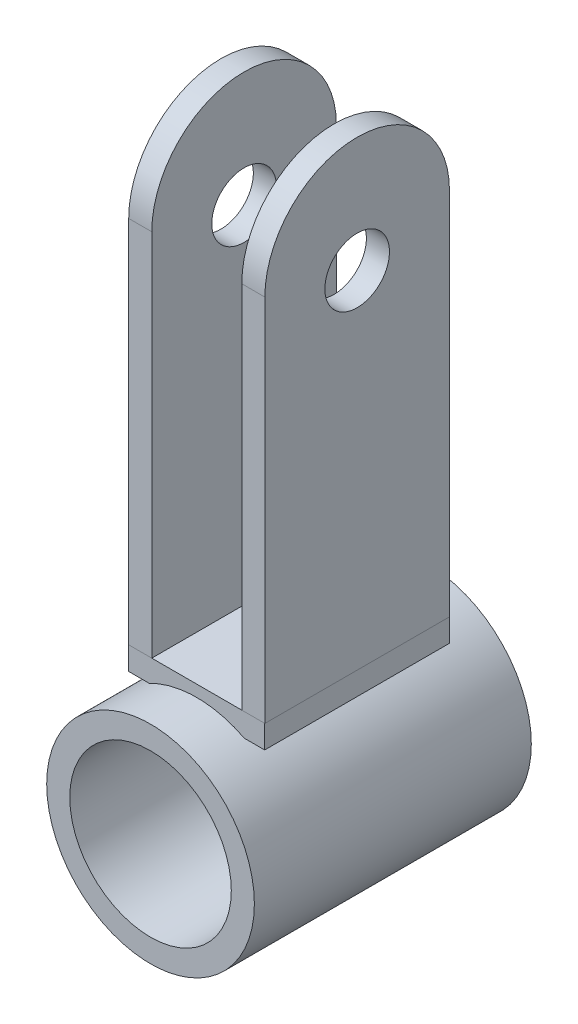
from build123d import *

# Parameters (mm, degrees)
SKETCH1_R           = 22.5
SKETCH1_R_2         = 17.5
BOSS_EXTRUDE1_DEPTH = 30
SKETCH6_W           = 29.462107424
SKETCH6_H           = 40
BOSS_EXTRUDE7_DEPTH = 5
SKETCH8_R           = 7
BOSS_EXTRUDE8_DEPTH = 5
LPATTERN2_COUNT     = 2
LPATTERN2_PITCH     = 24.5


with BuildPart() as part:
    # Sketch1 → Boss-Extrude1 (new, symmetric)
    with BuildSketch(Plane.XY):
        Circle(SKETCH1_R)
        Circle(SKETCH1_R_2, mode=Mode.SUBTRACT)
    extrude(amount=BOSS_EXTRUDE1_DEPTH, both=True)

    # Sketch6 → Boss-Extrude7 (add)
    with BuildSketch(Plane(origin=(0, 20, 0), x_dir=(1, 0, 0), z_dir=(0, 1, 0))):
        Rectangle(SKETCH6_W, SKETCH6_H)
    extrude(amount=BOSS_EXTRUDE7_DEPTH)


with BuildPart() as body_2:
    # Sketch8 → Boss-Extrude8 (new body)
    with BuildSketch(Plane.ZY.offset(14.731053712)):
        with BuildLine():
            Line((20, 25), (20, 105))
            ThreePointArc((20, 105), (0, 125), (-20, 105))
            Line((-20, 105), (-20, 25))
            Line((-20, 25), (20, 25))
        make_face()
        with Locations((0, 100)):
            Circle(SKETCH8_R, mode=Mode.SUBTRACT)
    boss_extrude8 = extrude(amount=-BOSS_EXTRUDE8_DEPTH)


with BuildPart() as lpattern2_1:
    # LPattern2: Boss-Extrude8 ×2
    with Locations(*[(i * LPATTERN2_PITCH, 0, 0) for i in range(1, LPATTERN2_COUNT)]):
        add(boss_extrude8)


solid = Compound([part.part, body_2.part, lpattern2_1.part])
